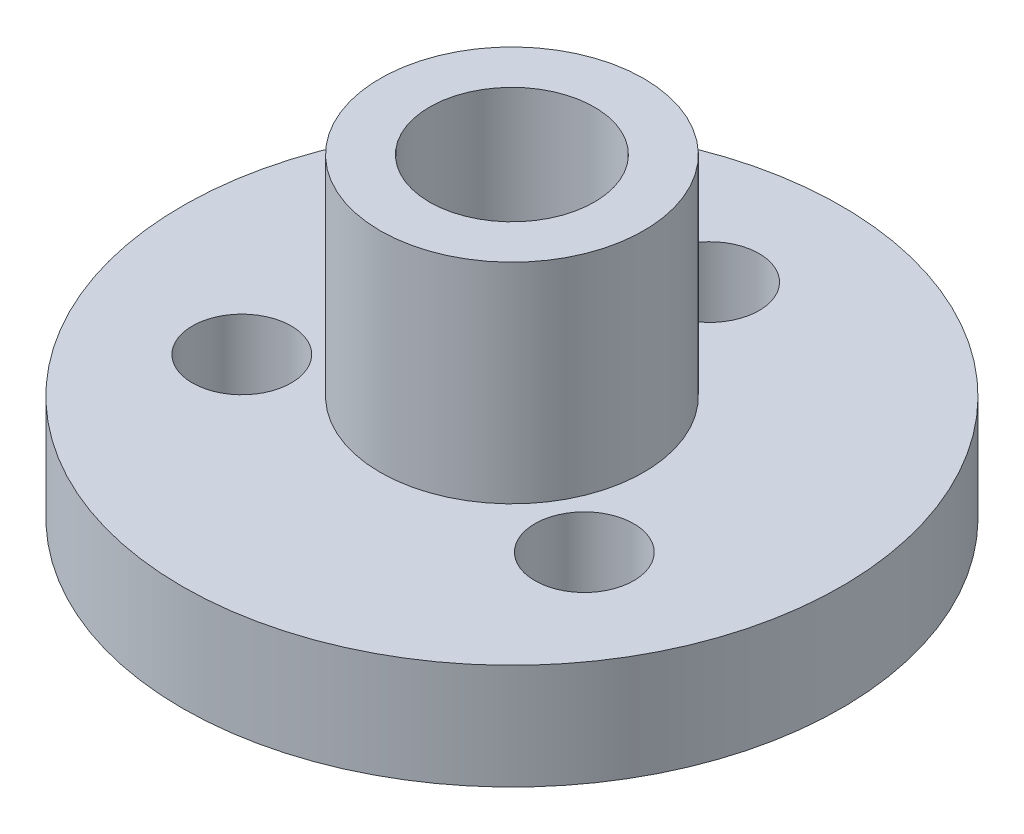
from build123d import *

# Parameters (mm, degrees)
SKETCH2_R          = 1.5
CUT_EXTRUDE1_DEPTH = 16.502338533


with BuildPart() as part:
    # Sketch1 → Revolve1 (revolve)
    with BuildSketch(Plane.XY, mode=Mode.PRIVATE) as revolve1_sk:
        Polygon((-2.5, 9.55), (-2.5, 0), (-10, 0), (-10, 3.2), (-4, 3.2), (-4, 9.55), align=None)
    revolve(revolve1_sk.sketch.rotate(Axis((0, 12.509773994, 0), (0, -1, 0)), 270), axis=Axis((0, 12.509773994, 0), (0, -1, 0)))

    # Sketch2 → Cut-Extrude1 (cut, through all)
    with BuildSketch(Plane(origin=(0, 3.2, 0), x_dir=(1, 0, 0), z_dir=(0, 1, 0))):
        with Locations(Location((0, 6, 0), (0, 0, 270))):
            Circle(SKETCH2_R)
        with Locations(Location((5.196152423, -3, 0), (0, 0, 270))):
            Circle(SKETCH2_R)
        with Locations(Location((-5.196152423, -3, 0), (0, 0, 270))):
            Circle(SKETCH2_R)
    extrude(amount=-CUT_EXTRUDE1_DEPTH, mode=Mode.SUBTRACT)


solid = part.part
